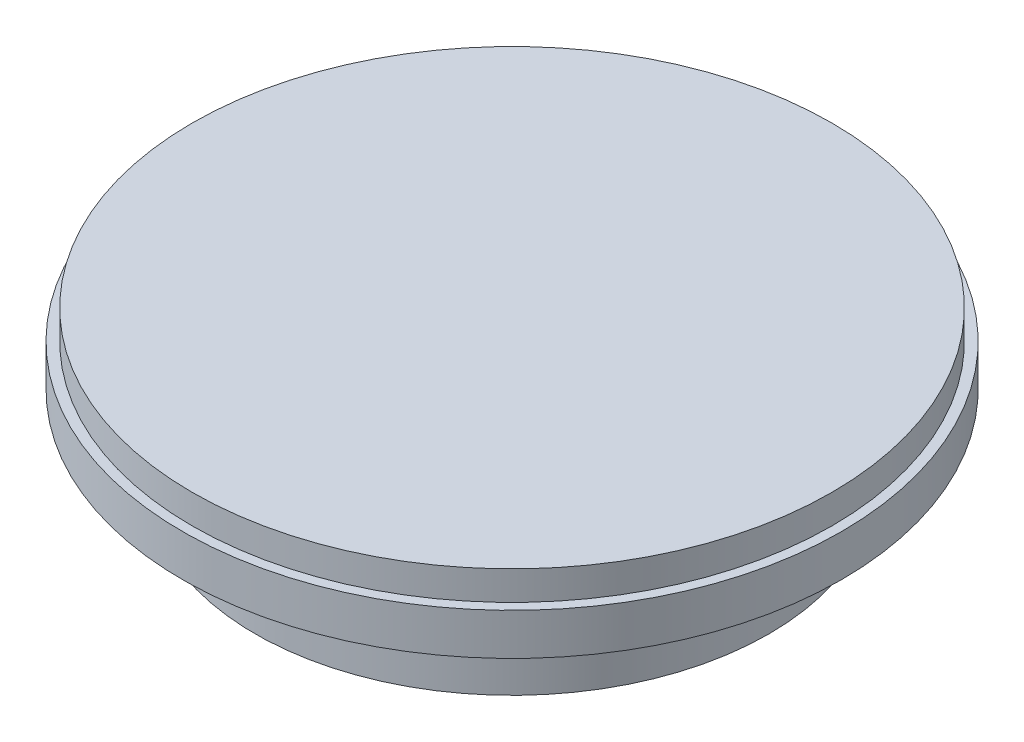
from build123d import *

# Parameters (mm, degrees)
SKETCH3_R                 = 33
BOSS_EXTRUDE1_DEPTH       = 3
M3X0_5_TAPPED_HOLE1_D     = 2.5
M3X0_5_TAPPED_HOLE1_DEPTH = 7.5
M3X0_5_TAPPED_HOLE1_TIP   = 0.751075774


with BuildPart() as part:
    # Sketch2 → Revolve1 (revolve)
    with BuildSketch(Plane.XY):
        Polygon((0, -6.45), (0, 6.45), (34, 6.45), (34, 2.15), (26.5, -0.85), (26.5, -6.45), align=None)
    revolve(axis=Axis((0, -6.45, 0), (0, 1, 0)))

    # Sketch3 → Boss-Extrude1 (add)
    with BuildSketch(Plane(origin=(0, 6.45, 0), x_dir=(1, 0, 0), z_dir=(0, 1, 0))):
        with Locations(Location((0, 0, 0), (0, 0, 180))):
            Circle(SKETCH3_R)
    extrude(amount=BOSS_EXTRUDE1_DEPTH)

    # M3x0.5 Tapped Hole1
    with Locations(Plane(origin=(0, -6.45, 0), x_dir=(-1, 0, 0), z_dir=(0, -1, 0))):
        with Locations((10.606601718, -10.606601718), (-10.606601718, -10.606601718), (-10.606601718, 10.606601718), (10.606601718, 10.606601718)):
            Hole(M3X0_5_TAPPED_HOLE1_D / 2, depth=M3X0_5_TAPPED_HOLE1_DEPTH)
            with Locations((0, 0, -(M3X0_5_TAPPED_HOLE1_DEPTH + M3X0_5_TAPPED_HOLE1_TIP / 2))):  # 118° drill point
                Cone(0, M3X0_5_TAPPED_HOLE1_D / 2, M3X0_5_TAPPED_HOLE1_TIP, mode=Mode.SUBTRACT)


solid = part.part
